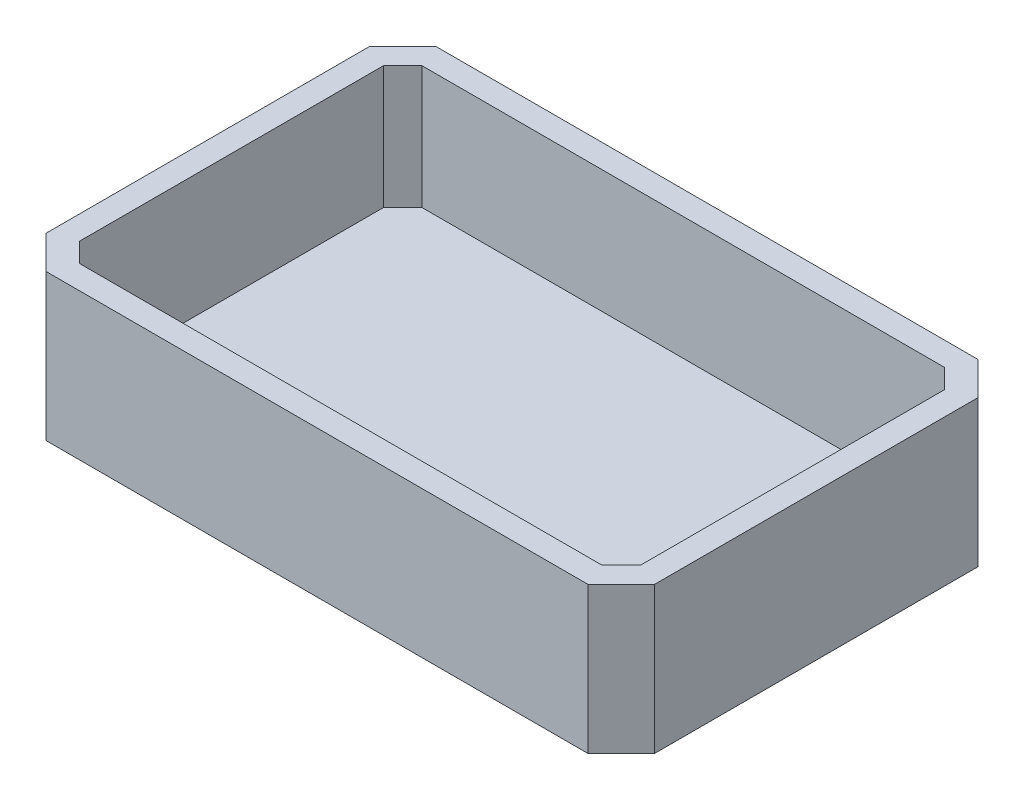
from build123d import *

# Parameters (mm, degrees)
SKETCH1_W           = 515
SKETCH1_H           = 330
BOSS_EXTRUDE1_DEPTH = 124
CHAMFER1_SIZE       = 28
SHELL1_T            = -20


with BuildPart() as part:
    # Sketch1 → Boss-Extrude1 (new body)
    with BuildSketch(Plane(origin=(0, 0, 0), x_dir=(1, 0, 0), z_dir=(0, 1, 0))):
        Rectangle(SKETCH1_W, SKETCH1_H)
    extrude(amount=BOSS_EXTRUDE1_DEPTH)

    # Chamfer1
    chamfer1_edges = [part.edges().sort_by_distance(p)[0] for p in [
        (257.5, 62, 165),
        (-257.5, 62, 165),
        (-257.5, 62, -165),
        (257.5, 62, -165),
    ]]
    chamfer(chamfer1_edges, length=CHAMFER1_SIZE)

    # Shell1
    shell1_openings = [part.faces().sort_by_distance(p)[0] for p in [
        (0, 124, 0),
    ]]
    offset(amount=SHELL1_T, openings=shell1_openings, kind=Kind.INTERSECTION)


solid = part.part
